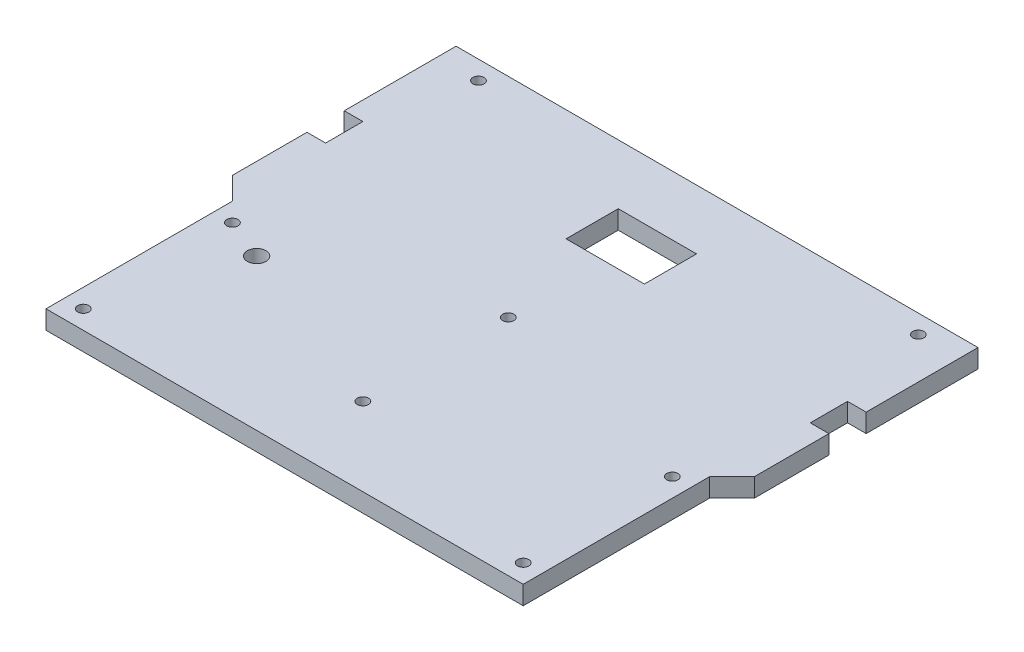
from build123d import *

# Parameters (mm, degrees)
SKETCH1_R           = 1.5
BOSS_EXTRUDE1_DEPTH = 5
SKETCH2_R           = 1.5
SKETCH2_R_2         = 2.5
SKETCH2_W           = 21
SKETCH2_H           = 14
CUT_EXTRUDE1_DEPTH  = 136.576546644


with BuildPart() as part:
    # Sketch1 → Boss-Extrude1 (new body)
    with BuildSketch(Plane(origin=(0, 0, 0), x_dir=(1, 0, 0), z_dir=(0, 1, 0))):
        Polygon((64, -116), (64, -66), (70, -60), (70, -40), (65, -40), (65, -30), (70, -30), (70, 0), (-70, 0), (-70, -30), (-65, -30), (-65, -40), (-70, -40), (-70, -60), (-64, -66), (-64, -116), align=None)
        with Locations(Location((59, -5, 0), (0, 0, 270))):
            Circle(SKETCH1_R, mode=Mode.SUBTRACT)
        with Locations(Location((59, -71, 0), (0, 0, 270))):
            Circle(SKETCH1_R, mode=Mode.SUBTRACT)
        with Locations(Location((59, -111, 0), (0, 0, 270))):
            Circle(SKETCH1_R, mode=Mode.SUBTRACT)
        with Locations(Location((-59, -111, 0), (0, 0, 90))):
            Circle(SKETCH1_R, mode=Mode.SUBTRACT)
        with Locations(Location((-59, -71, 0), (0, 0, 90))):
            Circle(SKETCH1_R, mode=Mode.SUBTRACT)
        with Locations(Location((-59, -5, 0), (0, 0, 90))):
            Circle(SKETCH1_R, mode=Mode.SUBTRACT)
    extrude(amount=BOSS_EXTRUDE1_DEPTH)

    # Sketch2 → Cut-Extrude1 (cut, through all)
    with BuildSketch(Plane(origin=(0, 5, 0), x_dir=(1, 0, 0), z_dir=(0, 1, 0))):
        with Locations(Location((0, -56, 0), (0, 0, 270))):
            Circle(SKETCH2_R)
        with Locations(Location((0, -95, 0), (0, 0, 270))):
            Circle(SKETCH2_R)
        with Locations(Location((-48, -75.5, 0), (0, 0, 270))):
            Circle(SKETCH2_R_2)
        with Locations((0, -23)):
            Rectangle(SKETCH2_W, SKETCH2_H)
    extrude(amount=-CUT_EXTRUDE1_DEPTH, mode=Mode.SUBTRACT)


solid = part.part
